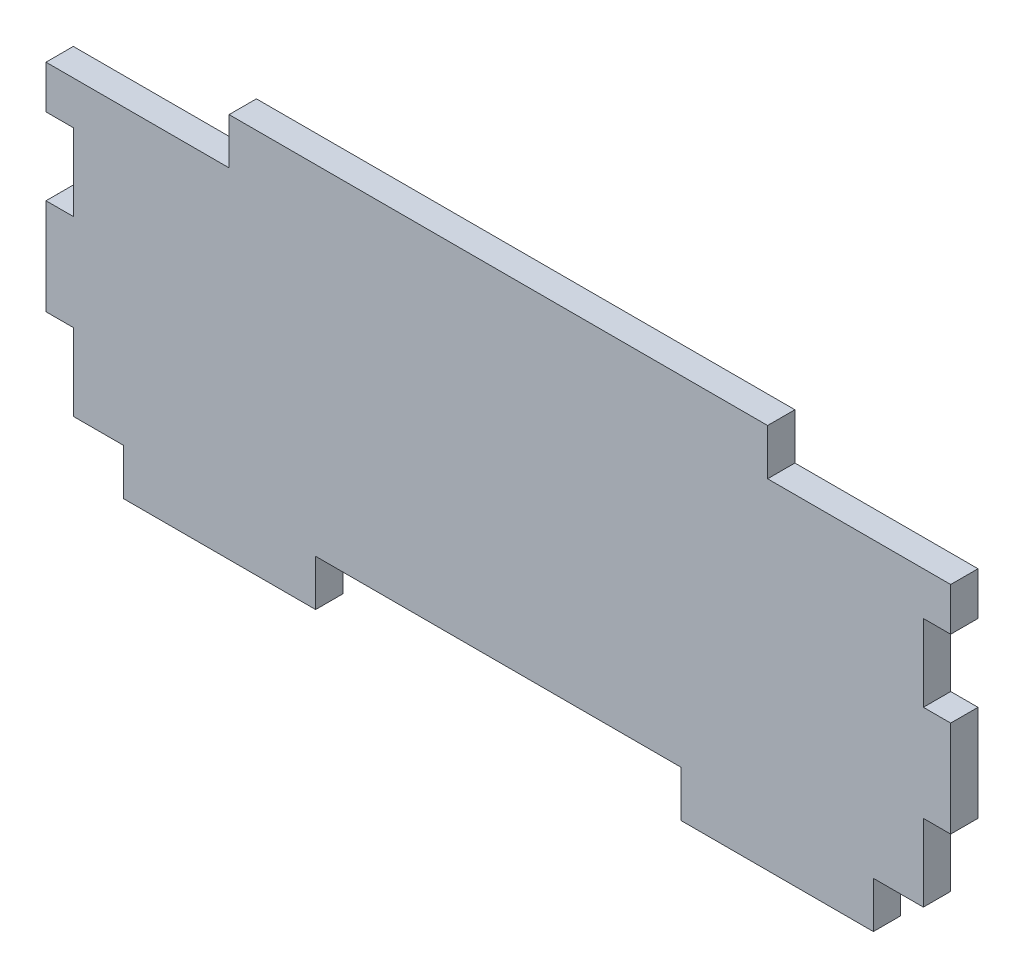
from build123d import *

# Parameters (mm, degrees)
BOSS_EXTRUDE1_DEPTH = 1.8034


with BuildPart() as part:
    # Sketch1 → Boss-Extrude1 (new body)
    with BuildSketch(Plane.XY):
        Polygon((1.8034, 9.8044), (0, 9.8044), (0, 4.7244), (-3.302, 4.7244), (-3.302, 1.6764), (-16.002, 1.6764), (-16.002, 4.7244), (-40.132, 4.7244), (-40.132, 1.6764), (-52.832, 1.6764), (-52.832, 4.7244), (-56.134, 4.7244), (-56.134, 9.8044), (-57.9374, 9.8044), (-57.9374, 16.1544), (-56.134, 16.1544), (-56.134, 21.2344), (-57.9374, 21.2344), (-57.9374, 24.0792), (-45.847, 24.0792), (-45.847, 27.1272), (-10.287, 27.1272), (-10.287, 24.0792), (1.8034, 24.0792), (1.8034, 21.2344), (0, 21.2344), (0, 16.1544), (1.8034, 16.1544), align=None)
    extrude(amount=BOSS_EXTRUDE1_DEPTH)


solid = part.part
